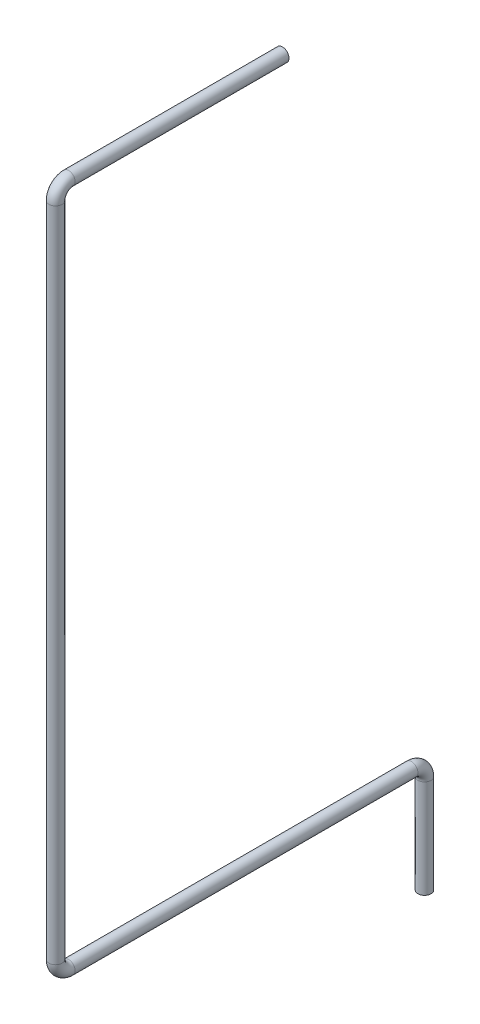
from build123d import *

# Parameters (mm, degrees)
BARRER1_PROFILE_R = 1


with BuildPart() as part:
    # Barrer1: sweep along a path in Croquis1
    with BuildLine(Plane(origin=(0, 0, 0), x_dir=(0, 0, -1), z_dir=(1, 0, 0))) as barrer1_path:
        Line((0, 0), (-32.66, 0))
        ThreePointArc((-32.66, 0), (-34.074213562, -0.585786438), (-34.66, -2))
        Line((-34.66, -2), (-34.66, -102.36))
        ThreePointArc((-34.66, -102.36), (-34.074213562, -103.774213562), (-32.66, -104.36))
        Line((-32.66, -104.36), (19.69, -104.36))
        ThreePointArc((19.69, -104.36), (21.104213562, -104.945786438), (21.69, -106.36))
        Line((21.69, -106.36), (21.69, -121.36))
    # Barrer1 profile (on start of the path) → Barrer1 (sweep)
    with BuildSketch(Plane(origin=(0, 0, 0), x_dir=(0, 1, 0), z_dir=(0, 0, 1))):
        Circle(BARRER1_PROFILE_R)
    sweep(path=barrer1_path.line)


solid = part.part
